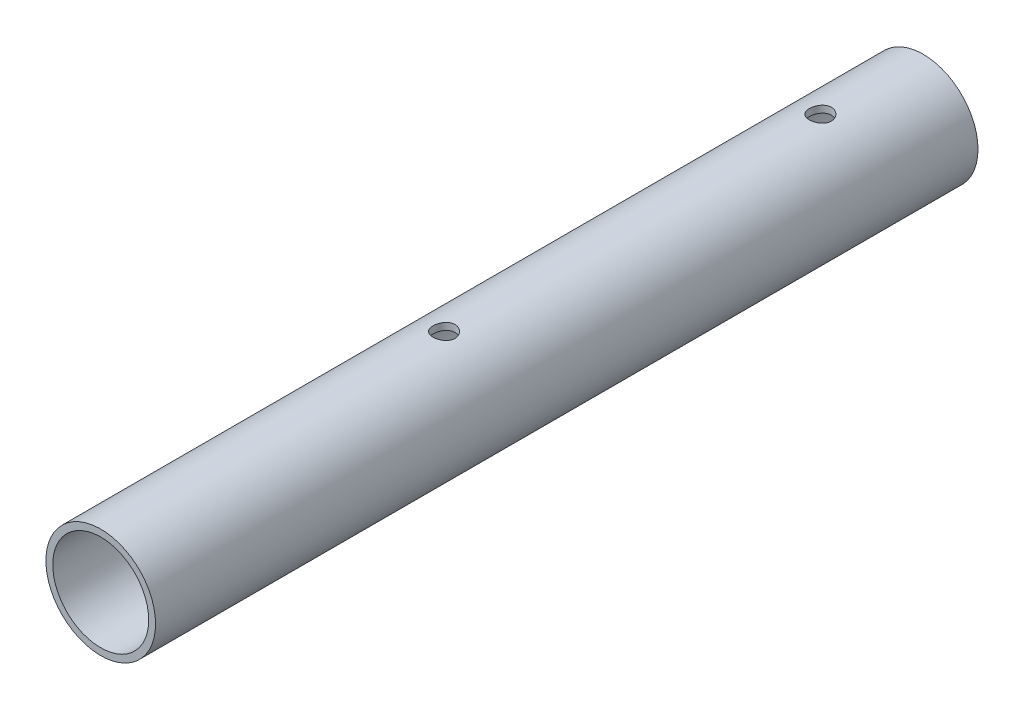
from build123d import *

# Parameters (mm, degrees)
SKETCH_1_R          = 8
SKETCH_1_R_2        = 7
EXTRUDE_1_DEPTH     = 120
SKETCH_2_R          = 1.6
CUT_EXTRUDE_1_DEPTH = 300


with BuildPart() as part:
    # 草图1 → 凸台-拉伸1 (new body)
    with BuildSketch(Plane.XY):
        Circle(SKETCH_1_R)
        Circle(SKETCH_1_R_2, mode=Mode.SUBTRACT)
    extrude(amount=EXTRUDE_1_DEPTH)

    # 草图2 → 切除-拉伸1 (cut, symmetric)
    with BuildSketch(Plane(origin=(0, 0, 0), x_dir=(1, 0, 0), z_dir=(0, 1, 0))):
        with Locations(Location((0, -15, 0), (0, 0, 270))):
            Circle(SKETCH_2_R)
        with Locations(Location((0, -69.91, 0), (0, 0, 270))):
            Circle(SKETCH_2_R)
    extrude(amount=CUT_EXTRUDE_1_DEPTH, both=True, mode=Mode.SUBTRACT)


solid = part.part
